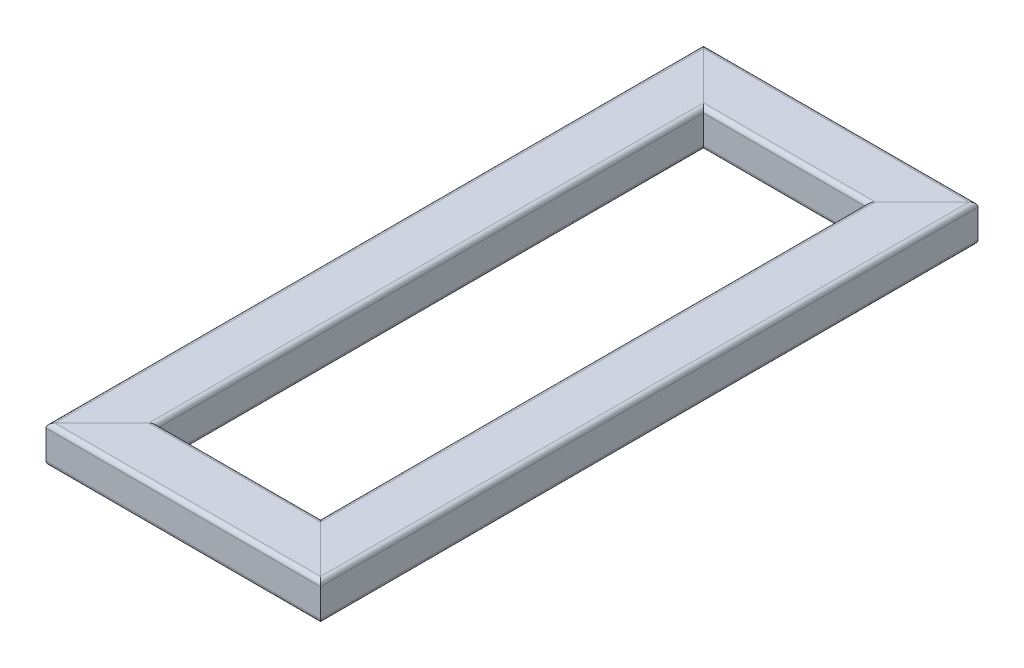
from build123d import *

# Parameters (mm, degrees)
TUBO_RECTANGULAR_3_X_2_X_0_25_1_DEPTH      = 990.581002397
TUBO_RECTANGULAR_3_X_2_X_0_25_1_DEPTH_BACK = 92.581002397
TUBO_RECTANGULAR_3_X_2_X_0_25_1_2_DEPTH    = 560.162004794
TUBO_RECTANGULAR_3_X_2_X_0_25_1_3_DEPTH    = 1083.162004794
TUBO_RECTANGULAR_3_X_2_X_0_25_1_4_DEPTH    = 560.162004794


with BuildPart() as part:
    # Sketch1 → Tubo rectangular 3 X 2 X 0.25(1) (new, two sides: drawn at the far end of the back side and taken through both)
    with BuildSketch(Plane(origin=(-149.4, 25.4, -449), x_dir=(1, 0, 0), z_dir=(0, 0, 1)).offset(-TUBO_RECTANGULAR_3_X_2_X_0_25_1_DEPTH_BACK)):
        with BuildLine():
            Line((-32.1, -25.4), (32.1, -25.4))
            ThreePointArc((32.1, -25.4), (36.342640687, -23.642640687), (38.1, -19.4))
            Line((38.1, -19.4), (38.1, 19.4))
            ThreePointArc((38.1, 19.4), (36.342640687, 23.642640687), (32.1, 25.4))
            Line((32.1, 25.4), (-32.1, 25.4))
            ThreePointArc((-32.1, 25.4), (-36.342640687, 23.642640687), (-38.1, 19.4))
            Line((-38.1, 19.4), (-38.1, -19.4))
            ThreePointArc((-38.1, -19.4), (-36.342640687, -23.642640687), (-32.1, -25.4))
        make_face()
        with BuildLine():
            Line((-32.1, -23.4), (32.1, -23.4))
            ThreePointArc((32.1, -23.4), (34.928427125, -22.228427125), (36.1, -19.4))
            Line((36.1, -19.4), (36.1, 19.4))
            ThreePointArc((36.1, 19.4), (34.928427125, 22.228427125), (32.1, 23.4))
            Line((32.1, 23.4), (-32.1, 23.4))
            ThreePointArc((-32.1, 23.4), (-34.928427125, 22.228427125), (-36.1, 19.4))
            Line((-36.1, 19.4), (-36.1, -19.4))
            ThreePointArc((-36.1, -19.4), (-34.928427125, -22.228427125), (-32.1, -23.4))
        make_face(mode=Mode.SUBTRACT)
    extrude(amount=TUBO_RECTANGULAR_3_X_2_X_0_25_1_DEPTH + TUBO_RECTANGULAR_3_X_2_X_0_25_1_DEPTH_BACK)

    # Tubo rectangular 3 X 2 X 0.25(1) mitre 1
    split(bisect_by=Plane(origin=(-187.5, 0, -449), x_dir=(0, -1, 0), z_dir=(-0.707106781, 0, 0.707106781)), keep=Keep.TOP)

    # Tubo rectangular 3 X 2 X 0.25(1) mitre 2
    split(bisect_by=Plane(origin=(-187.5, 0, 449), x_dir=(0, -1, 0), z_dir=(-0.707106781, 0, -0.707106781)), keep=Keep.TOP)


with BuildPart() as body_2:
    # Sketch1 on segment 2 (carried to segment 2) → Tubo rectangular 3 X 2 X 0.25_1 2 (new body)
    with BuildSketch(Plane(origin=(-280.081002397, 25.4, 410.9), x_dir=(0, 0, -1), z_dir=(1, 0, 0))):
        with BuildLine():
            Line((-32.1, -25.4), (32.1, -25.4))
            ThreePointArc((32.1, -25.4), (36.342640687, -23.642640687), (38.1, -19.4))
            Line((38.1, -19.4), (38.1, 19.4))
            ThreePointArc((38.1, 19.4), (36.342640687, 23.642640687), (32.1, 25.4))
            Line((32.1, 25.4), (-32.1, 25.4))
            ThreePointArc((-32.1, 25.4), (-36.342640687, 23.642640687), (-38.1, 19.4))
            Line((-38.1, 19.4), (-38.1, -19.4))
            ThreePointArc((-38.1, -19.4), (-36.342640687, -23.642640687), (-32.1, -25.4))
        make_face()
        with BuildLine():
            Line((-32.1, -23.4), (32.1, -23.4))
            ThreePointArc((32.1, -23.4), (34.928427125, -22.228427125), (36.1, -19.4))
            Line((36.1, -19.4), (36.1, 19.4))
            ThreePointArc((36.1, 19.4), (34.928427125, 22.228427125), (32.1, 23.4))
            Line((32.1, 23.4), (-32.1, 23.4))
            ThreePointArc((-32.1, 23.4), (-34.928427125, 22.228427125), (-36.1, 19.4))
            Line((-36.1, 19.4), (-36.1, -19.4))
            ThreePointArc((-36.1, -19.4), (-34.928427125, -22.228427125), (-32.1, -23.4))
        make_face(mode=Mode.SUBTRACT)
    extrude(amount=TUBO_RECTANGULAR_3_X_2_X_0_25_1_2_DEPTH)

    # Tubo rectangular 3 X 2 X 0.25_1 2 mitre
    split(bisect_by=Plane(origin=(-187.5, 0, 449), x_dir=(0, 1, 0), z_dir=(0.707106781, 0, 0.707106781)), keep=Keep.TOP)

    # Tubo rectangular 3 X 2 X 0.25_1 2 mi 2
    split(bisect_by=Plane(origin=(187.5, 0, 449), x_dir=(0, -1, 0), z_dir=(-0.707106781, 0, 0.707106781)), keep=Keep.TOP)


with BuildPart() as body_3:
    # Sketch1 on segment 3 (carried to segment 3) → Tubo rectangular 3 X 2 X 0.25_1 3 (new body)
    with BuildSketch(Plane(origin=(149.4, 25.4, 541.581002397), x_dir=(-1, 0, 0), z_dir=(0, 0, -1))):
        with BuildLine():
            Line((-32.1, -25.4), (32.1, -25.4))
            ThreePointArc((32.1, -25.4), (36.342640687, -23.642640687), (38.1, -19.4))
            Line((38.1, -19.4), (38.1, 19.4))
            ThreePointArc((38.1, 19.4), (36.342640687, 23.642640687), (32.1, 25.4))
            Line((32.1, 25.4), (-32.1, 25.4))
            ThreePointArc((-32.1, 25.4), (-36.342640687, 23.642640687), (-38.1, 19.4))
            Line((-38.1, 19.4), (-38.1, -19.4))
            ThreePointArc((-38.1, -19.4), (-36.342640687, -23.642640687), (-32.1, -25.4))
        make_face()
        with BuildLine():
            Line((-32.1, -23.4), (32.1, -23.4))
            ThreePointArc((32.1, -23.4), (34.928427125, -22.228427125), (36.1, -19.4))
            Line((36.1, -19.4), (36.1, 19.4))
            ThreePointArc((36.1, 19.4), (34.928427125, 22.228427125), (32.1, 23.4))
            Line((32.1, 23.4), (-32.1, 23.4))
            ThreePointArc((-32.1, 23.4), (-34.928427125, 22.228427125), (-36.1, 19.4))
            Line((-36.1, 19.4), (-36.1, -19.4))
            ThreePointArc((-36.1, -19.4), (-34.928427125, -22.228427125), (-32.1, -23.4))
        make_face(mode=Mode.SUBTRACT)
    extrude(amount=TUBO_RECTANGULAR_3_X_2_X_0_25_1_3_DEPTH)

    # Tubo rectangular 3 X 2 X 0.25_1 3 mitre
    split(bisect_by=Plane(origin=(187.5, 0, -449), x_dir=(0, 1, 0), z_dir=(0.707106781, 0, 0.707106781)), keep=Keep.TOP)

    # Tubo rectangular 3 X 2 X 0.25_1 3 mi 2
    split(bisect_by=Plane(origin=(187.5, 0, 449), x_dir=(0, 1, 0), z_dir=(0.707106781, 0, -0.707106781)), keep=Keep.TOP)


with BuildPart() as body_4:
    # Sketch1 on segment 4 (carried to segment 4) → Tubo rectangular 3 X 2 X 0.25_1 4 (new body)
    with BuildSketch(Plane(origin=(280.081002397, 25.4, -410.9), x_dir=(0, 0, 1), z_dir=(-1, 0, 0))):
        with BuildLine():
            Line((-32.1, -25.4), (32.1, -25.4))
            ThreePointArc((32.1, -25.4), (36.342640687, -23.642640687), (38.1, -19.4))
            Line((38.1, -19.4), (38.1, 19.4))
            ThreePointArc((38.1, 19.4), (36.342640687, 23.642640687), (32.1, 25.4))
            Line((32.1, 25.4), (-32.1, 25.4))
            ThreePointArc((-32.1, 25.4), (-36.342640687, 23.642640687), (-38.1, 19.4))
            Line((-38.1, 19.4), (-38.1, -19.4))
            ThreePointArc((-38.1, -19.4), (-36.342640687, -23.642640687), (-32.1, -25.4))
        make_face()
        with BuildLine():
            Line((-32.1, -23.4), (32.1, -23.4))
            ThreePointArc((32.1, -23.4), (34.928427125, -22.228427125), (36.1, -19.4))
            Line((36.1, -19.4), (36.1, 19.4))
            ThreePointArc((36.1, 19.4), (34.928427125, 22.228427125), (32.1, 23.4))
            Line((32.1, 23.4), (-32.1, 23.4))
            ThreePointArc((-32.1, 23.4), (-34.928427125, 22.228427125), (-36.1, 19.4))
            Line((-36.1, 19.4), (-36.1, -19.4))
            ThreePointArc((-36.1, -19.4), (-34.928427125, -22.228427125), (-32.1, -23.4))
        make_face(mode=Mode.SUBTRACT)
    extrude(amount=TUBO_RECTANGULAR_3_X_2_X_0_25_1_4_DEPTH)

    # Tubo rectangular 3 X 2 X 0.25_1 4 mitre
    split(bisect_by=Plane(origin=(-187.5, 0, -449), x_dir=(0, 1, 0), z_dir=(0.707106781, 0, -0.707106781)), keep=Keep.TOP)

    # Tubo rectangular 3 X 2 X 0.25_1 4 mi 2
    split(bisect_by=Plane(origin=(187.5, 0, -449), x_dir=(0, -1, 0), z_dir=(-0.707106781, 0, -0.707106781)), keep=Keep.TOP)


solid = Compound([part.part, body_2.part, body_3.part, body_4.part])
